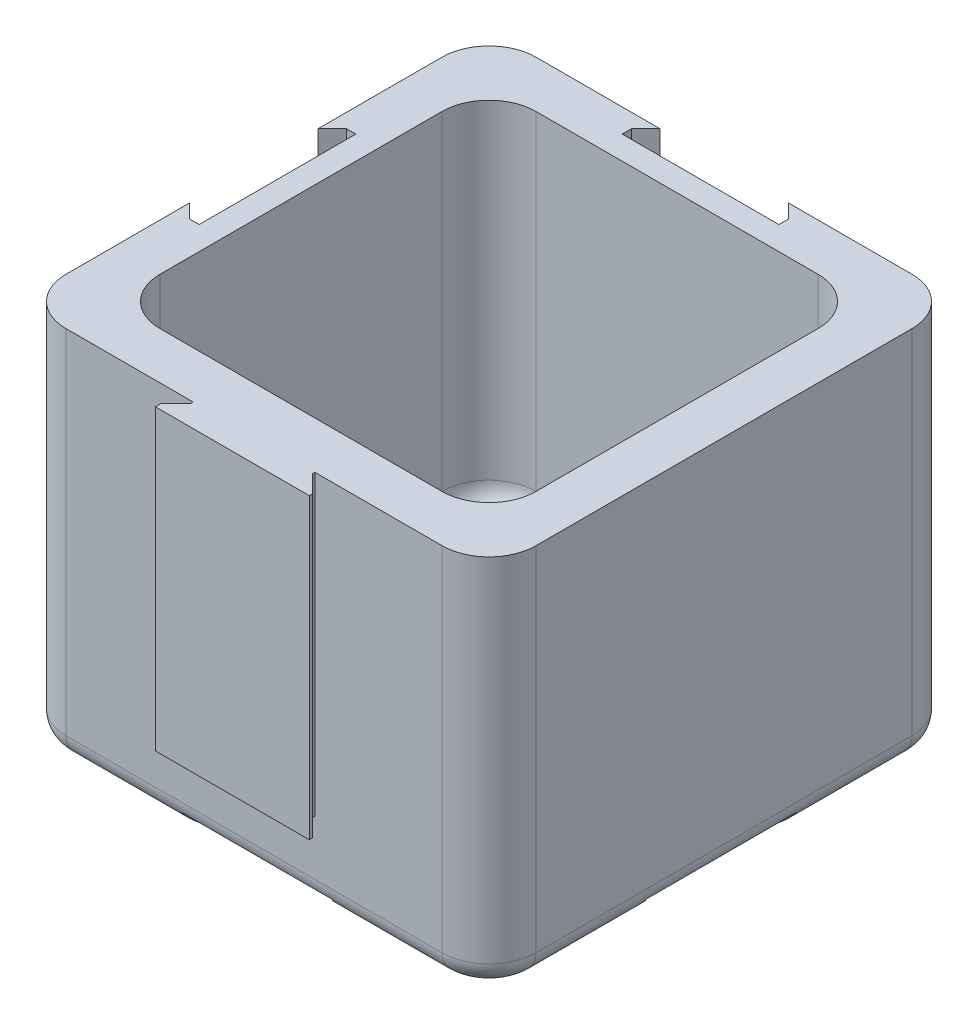
from build123d import *

# Parameters (mm, degrees)
SKETCH1_W                 = 100
SKETCH1_H                 = 100
BOSS_EXTRUDE1_DEPTH       = 80
SHELL1_T                  = -10
SHELL1_THICKNESS_2_FACE_W = 80
SHELL1_THICKNESS_2_FACE_H = 80
SHELL1_THICKNESS_2_DEPTH  = 5
CUT_EXTRUDE1_DEPTH        = 64
BOSS_EXTRUDE2_DEPTH       = 63.4
CUT_EXTRUDE2_DEPTH        = 64
FILLET1_R                 = 10
FILLET2_R                 = 5
SKETCH6_R                 = 12.5
CUT_EXTRUDE3_DEPTH        = 106.541508422
CUT_EXTRUDE4_DEPTH        = 2.5
FILLET4_R                 = 5
SKETCH7_W                 = 1.25
SKETCH7_H                 = 25
SKETCH7_W_2               = 26.25
SKETCH7_H_2               = 26.25
SKETCH7_W_3               = 23.75
SKETCH7_H_3               = 23.75
SKETCH7_W_4               = 25
SKETCH7_H_4               = 1.25
EXTRUDE_THIN1_DEPTH       = 2.5


with BuildPart() as part:
    # Sketch1 → Boss-Extrude1 (new body)
    with BuildSketch(Plane(origin=(0, 0, 0), x_dir=(1, 0, 0), z_dir=(0, 1, 0))):
        Rectangle(SKETCH1_W, SKETCH1_H)
    extrude(amount=BOSS_EXTRUDE1_DEPTH)

    # Shell1
    shell1_openings = [part.faces().sort_by_distance(p)[0] for p in [
        (0, 80, 0),
    ]]
    offset(amount=SHELL1_T, openings=shell1_openings, kind=Kind.INTERSECTION)

    # Shell1 thickness 2 face (on inner face of the shell) → Shell1 thickness 2 (cut)
    with BuildSketch(Plane(origin=(0, 10, 0), x_dir=(0, 0, -1), z_dir=(0, -1, 0))):
        Rectangle(SHELL1_THICKNESS_2_FACE_W, SHELL1_THICKNESS_2_FACE_H)
    extrude(amount=SHELL1_THICKNESS_2_DEPTH, mode=Mode.SUBTRACT)

    # Sketch2 → Cut-Extrude1 (cut)
    with BuildSketch(Plane(origin=(0, 80, 0), x_dir=(1, 0, 0), z_dir=(0, 1, 0))):
        Polygon((-13.666666667, 50), (-16.666666667, 47), (-16.666666667, 45), (16.666666667, 45), (16.666666667, 47), (13.666666667, 50), align=None)
    extrude(amount=-CUT_EXTRUDE1_DEPTH, mode=Mode.SUBTRACT)

    # Sketch3 → Boss-Extrude2 (add)
    with BuildSketch(Plane(origin=(0, 80, 0), x_dir=(1, 0, 0), z_dir=(0, 1, 0))):
        Polygon((-12.942402598, -50.5), (-16.066666667, -53.624264069), (-16.066666667, -54.9), (16.666666667, -54.9), (16.666666667, -54.224264069), (12.942402598, -50.5), (12.942402598, -50), (-12.942402598, -50), align=None)
    extrude(amount=-BOSS_EXTRUDE2_DEPTH)

    # Sketch4 → Cut-Extrude2 (cut)
    with BuildSketch(Plane(origin=(0, 80, 0), x_dir=(1, 0, 0), z_dir=(0, 1, 0))):
        Polygon((-45, 16.666666667), (-45, -16.666666667), (-47, -16.666666667), (-50, -13.666666667), (-50, 13.666666667), (-47, 16.666666667), align=None)
    extrude(amount=-CUT_EXTRUDE2_DEPTH, mode=Mode.SUBTRACT)

    # Fillet1
    fillet1_edges = [part.edges().sort_by_distance(p)[0] for p in [
        (40, 42.5, 40),
        (40, 42.5, -40),
        (-40, 42.5, -40),
        (-40, 42.5, 40),
        (50, 40, 50),
        (-50, 40, 50),
        (-50, 40, -50),
        (50, 40, -50),
    ]]
    fillet(fillet1_edges, radius=FILLET1_R)

    # Fillet2
    fillet2_edges = [part.edges().sort_by_distance(p)[0] for p in [
        (40, 5, 0),
        (0, 5, -40),
        (-40, 5, 0),
        (0, 5, 40),
        (37.071067812, 5, 37.071067812),
        (-37.071067812, 5, 37.071067812),
        (-37.071067812, 5, -37.071067812),
        (37.071067812, 5, -37.071067812),
        (0, 0, -50),
        (50, 0, 0),
        (0, 0, 50),
        (-50, 0, 0),
        (47.071067812, 0, 47.071067812),
        (-47.071067812, 0, 47.071067812),
        (-47.071067812, 0, -47.071067812),
        (47.071067812, 0, -47.071067812),
    ]]
    fillet(fillet2_edges, radius=FILLET2_R)

    # Sketch6 → Cut-Extrude3 (cut, through all)
    with BuildSketch(Plane(origin=(0, 5, 0), x_dir=(1, 0, 0), z_dir=(0, 1, 0))):
        with Locations(Location((0, 0, 0), (0, 0, 270))):
            Circle(SKETCH6_R)
    extrude(amount=-CUT_EXTRUDE3_DEPTH, mode=Mode.SUBTRACT)

    # Sketch9 → Cut-Extrude4 (cut)
    with BuildSketch(Plane.XZ):
        Polygon((-6.25, 10.825317547), (-6.25, 39.583333333), (-16.666666667, 50), (16.666666667, 50), (6.25, 39.583333333), (6.25, 10.825317547), align=None)
        Polygon((10.825317547, 6.25), (39.583333333, 6.25), (50, 16.666666667), (50, -16.666666667), (39.583333333, -6.25), (10.825317547, -6.25), align=None)
        Polygon((-16.666666667, -50), (16.666666667, -50), (6.25, -39.583333333), (6.25, -10.825317547), (-6.25, -10.825317547), (-6.25, -39.583333333), align=None)
        Polygon((-39.583333333, -6.25), (-10.825317547, -6.25), (-10.825317547, 6.25), (-39.583333333, 6.25), (-50, 16.666666667), (-50, -16.666666667), align=None)
    extrude(amount=-CUT_EXTRUDE4_DEPTH, mode=Mode.SUBTRACT)

    # Fillet4
    fillet4_edges = [part.edges().sort_by_distance(p)[0] for p in [
        (-6.25, 1.25, -39.583333333),
        (6.25, 1.25, -39.583333333),
        (39.583333333, 1.25, 6.25),
        (39.583333333, 1.25, -6.25),
        (-39.583333333, 1.25, -6.25),
        (-39.583333333, 1.25, 6.25),
        (-6.25, 1.25, 39.583333333),
        (6.25, 1.25, 39.583333333),
    ]]
    fillet(fillet4_edges, radius=FILLET4_R)

    # Sketch7 → Extrude-Thin1 (add)
    # profile 1 of 9: a face of its own
    with BuildSketch(Plane(origin=(0, 5, 0), x_dir=(1, 0, 0), z_dir=(0, 1, 0))):
        with Locations((-7.5, 0)):
            Rectangle(SKETCH7_W, SKETCH7_H)
    # profile 2 of 9: a face of its own
    with BuildSketch(Plane(origin=(0, 5, 0), x_dir=(1, 0, 0), z_dir=(0, 1, 0))):
        Rectangle(SKETCH7_W_2, SKETCH7_H_2)
        Rectangle(SKETCH7_W_3, SKETCH7_H_3, mode=Mode.SUBTRACT)
    # profile 3 of 9: a face of its own
    with BuildSketch(Plane(origin=(0, 5, 0), x_dir=(1, 0, 0), z_dir=(0, 1, 0))):
        with Locations((-2.5, 0)):
            Rectangle(SKETCH7_W, SKETCH7_H)
    # profile 4 of 9: a face of its own
    with BuildSketch(Plane(origin=(0, 5, 0), x_dir=(1, 0, 0), z_dir=(0, 1, 0))):
        with Locations((2.5, 0)):
            Rectangle(SKETCH7_W, SKETCH7_H)
    # profile 5 of 9: a face of its own
    with BuildSketch(Plane(origin=(0, 5, 0), x_dir=(1, 0, 0), z_dir=(0, 1, 0))):
        with Locations((7.5, 0)):
            Rectangle(SKETCH7_W, SKETCH7_H)
    # profile 6 of 9: a face of its own
    with BuildSketch(Plane(origin=(0, 5, 0), x_dir=(1, 0, 0), z_dir=(0, 1, 0))):
        with Locations((0, 7.5)):
            Rectangle(SKETCH7_W_4, SKETCH7_H_4)
    # profile 7 of 9: a face of its own
    with BuildSketch(Plane(origin=(0, 5, 0), x_dir=(1, 0, 0), z_dir=(0, 1, 0))):
        with Locations((0, 2.5)):
            Rectangle(SKETCH7_W_4, SKETCH7_H_4)
    # profile 8 of 9: a face of its own
    with BuildSketch(Plane(origin=(0, 5, 0), x_dir=(1, 0, 0), z_dir=(0, 1, 0))):
        with Locations((0, -2.5)):
            Rectangle(SKETCH7_W_4, SKETCH7_H_4)
    # profile 9 of 9: a face of its own
    with BuildSketch(Plane(origin=(0, 5, 0), x_dir=(1, 0, 0), z_dir=(0, 1, 0))):
        with Locations((0, -7.5)):
            Rectangle(SKETCH7_W_4, SKETCH7_H_4)
    extrude(amount=-EXTRUDE_THIN1_DEPTH)


solid = part.part
